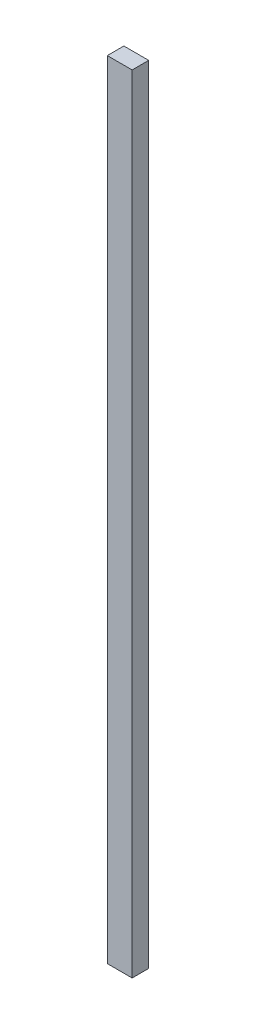
from build123d import *

# Parameters (mm, degrees)
SKETCH1_W           = 12
SKETCH1_H           = 379.5
BOSS_EXTRUDE1_DEPTH = 8


with BuildPart() as part:
    # Sketch1 → Boss-Extrude1 (new body)
    with BuildSketch(Plane(origin=(0, 0, -38.1), x_dir=(-1, 0, 0), z_dir=(0, 0, -1))):
        with Locations((0, 414.381527045)):
            Rectangle(SKETCH1_W, SKETCH1_H)
    extrude(amount=BOSS_EXTRUDE1_DEPTH)


solid = part.part
